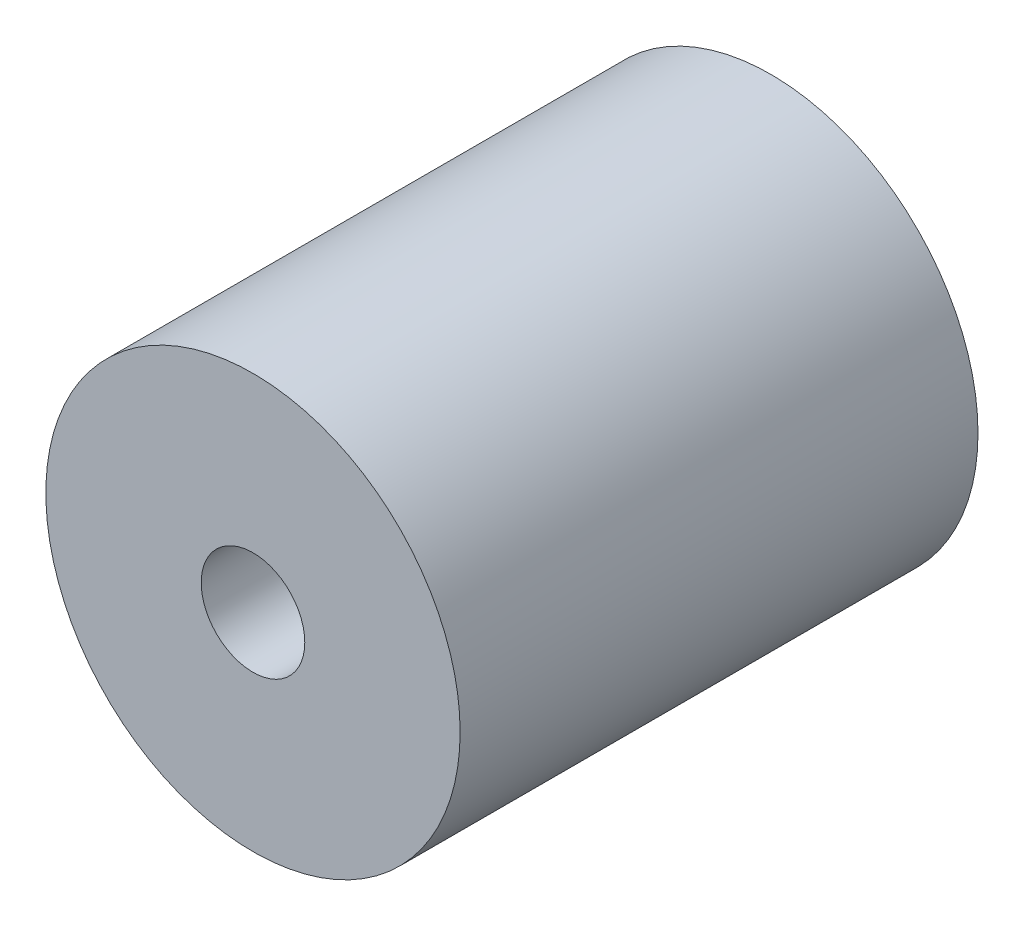
from build123d import *

# Parameters (mm, degrees)
SKETCH_1_R      = 10
SKETCH_1_R_2    = 2.5
EXTRUDE_1_DEPTH = 25


with BuildPart() as part:
    # 스케치1 → 보스-돌출1 (new body)
    with BuildSketch(Plane.XY):
        Circle(SKETCH_1_R)
        Circle(SKETCH_1_R_2, mode=Mode.SUBTRACT)
    extrude(amount=EXTRUDE_1_DEPTH)


solid = part.part
